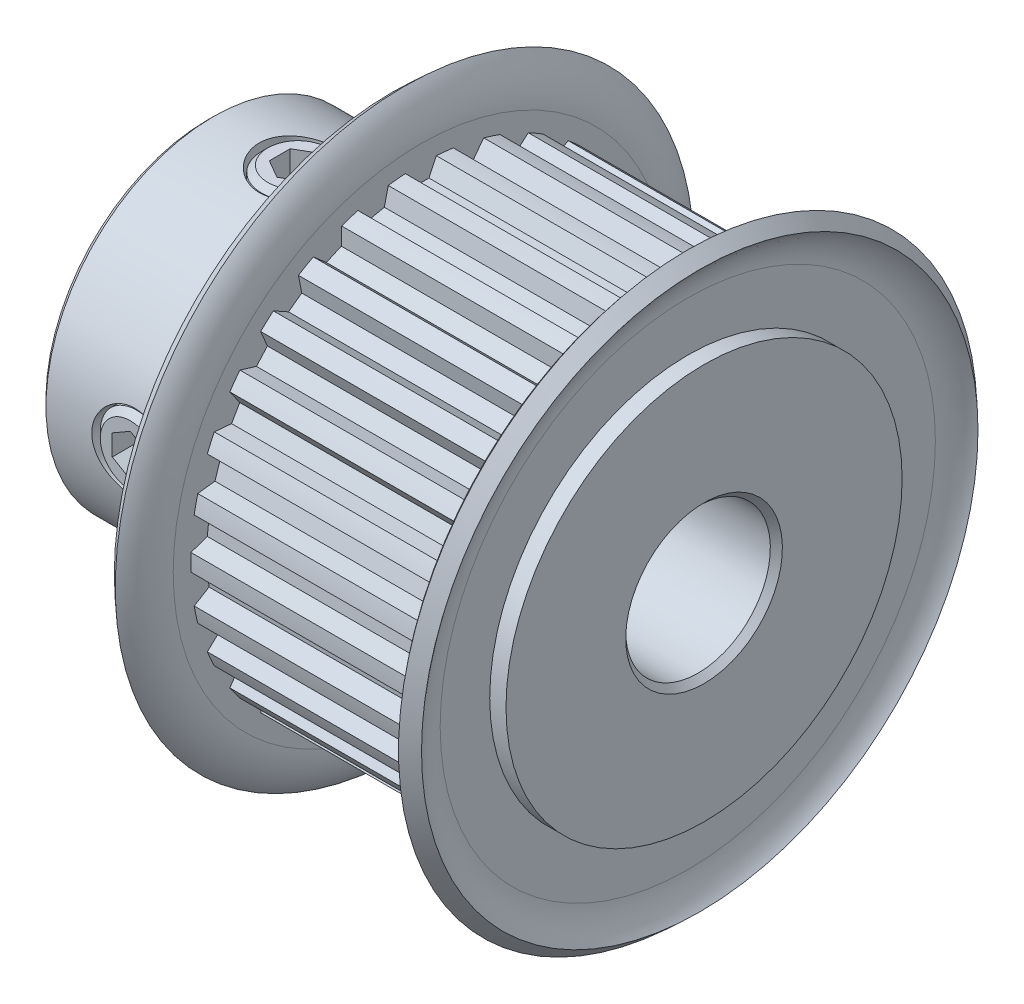
from build123d import *

# Parameters (mm, degrees)
SKETCH4_R          = 9.7
SKETCH4_R_2        = 9.54125
CUT_EXTRUDE2_DEPTH = 10.4
CUT_EXTRUDE1_DEPTH = 10.4
CIRPATTERN1_COUNT  = 30
SKETCH6_R          = 1.6
CUT_EXTRUDE3_DEPTH = 20.851700179
CUT_EXTRUDE4_DEPTH = 1.016
CIRPATTERN2_COUNT  = 2
CIRPATTERN2_ANGLE  = 90
CIRPATTERN3_COUNT  = 2
CIRPATTERN3_ANGLE  = 90
CHAMFER1_SIZE      = 0.25


with BuildPart() as part:
    # Sketch1 → Revolve1 (revolve)
    with BuildSketch(Plane.XY, mode=Mode.PRIVATE) as revolve1_sk:
        with BuildLine():
            Line((-10.3, 3), (10.3, 3))
            Line((10.3, 3), (10.3, 12))
            Line((10.3, 12), (9.625, 12))
            ThreePointArc((9.625, 12), (9.124735294, 11.199311572), (8.95, 10.2715))
            Line((8.95, 10.2715), (8.95, 9.7))
            Line((8.95, 9.7), (-1.45, 9.7))
            Line((-1.45, 9.7), (-1.45, 10.2715))
            ThreePointArc((-1.45, 10.2715), (-1.624735294, 11.199311572), (-2.125, 12))
            Line((-2.125, 12), (-2.8, 12))
            Line((-2.8, 12), (-2.8, 6.95))
            Line((-2.8, 6.95), (-10.3, 6.95))
            Line((-10.3, 6.95), (-10.3, 3))
        make_face()
    revolve(revolve1_sk.sketch.rotate(Axis((-10.3, 0, 0), (1, 0, 0)), 180), axis=Axis((-10.3, 0, 0), (1, 0, 0)))

    # Sketch4 → Cut-Extrude2 (cut)
    with BuildSketch(Plane(origin=(-1.45, 0, 0), x_dir=(0, 0, -1), z_dir=(1, 0, 0))):
        Circle(SKETCH4_R)
        with Locations(Location((0, 0, 0), (0, 0, 90))):
            Circle(SKETCH4_R_2, mode=Mode.SUBTRACT)
    extrude(amount=CUT_EXTRUDE2_DEPTH, mode=Mode.SUBTRACT)

    # Sketch3 → Cut-Extrude1 (cut)
    with BuildSketch(Plane(origin=(-1.45, 0, 0), x_dir=(0, 0, -1), z_dir=(1, 0, 0))):
        with BuildLine():
            Line((-0.643519092, 9.519523872), (-0.339706568, 8.867995811))
            Line((-0.339706568, 8.867995811), (0.339706568, 8.867995811))
            Line((0.339706568, 8.867995811), (0.643519092, 9.519523872))
            ThreePointArc((0.643519092, 9.519523872), (0, 9.54125), (-0.643519092, 9.519523872))
        make_face()
    cut_extrude1 = extrude(amount=CUT_EXTRUDE1_DEPTH, mode=Mode.SUBTRACT)

    # CirPattern1: Cut-Extrude1 ×30 about axis
    cirpattern1_axis = Axis((0, 0, 0), (1, 0, 0))
    for i in range(1, CIRPATTERN1_COUNT):
        add(cut_extrude1.rotate(cirpattern1_axis, i * 360 / CIRPATTERN1_COUNT), mode=Mode.SUBTRACT)

    # Sketch6 → Cut-Extrude3 (cut, through all)
    with BuildSketch(Plane(origin=(0, 0, 0), x_dir=(1, 0, 0), z_dir=(0, 1, 0))):
        with Locations(Location((-6.55, 0, 0), (0, 0, 90))):
            Circle(SKETCH6_R)
    cut_extrude3 = extrude(amount=CUT_EXTRUDE3_DEPTH, mode=Mode.SUBTRACT)

    # CirPattern2: Cut-Extrude3 ×2 about axis
    cirpattern2_axis = Axis((-10.3, 0, 0), (1, 0, 0))
    for i in range(1, CIRPATTERN2_COUNT):
        add(cut_extrude3.rotate(cirpattern2_axis, i * CIRPATTERN2_ANGLE / (CIRPATTERN2_COUNT - 1)), mode=Mode.SUBTRACT)

    # Chamfer1
    chamfer1_edges = [part.edges().sort_by_distance(p)[0] for p in [
        (-10.3, 6.95, 0),
        (-10.3, 3, 0),
        (10.3, 3, 0),
    ]]
    chamfer(chamfer1_edges, length=CHAMFER1_SIZE)

    # Sketch9 → Cut-Revolve1 (revolve, cut)
    with BuildSketch(Plane.XY, mode=Mode.PRIVATE) as cut_revolve1_sk:
        with BuildLine():
            Line((9.625, 12), (10.121366975, 11.542567135))
            ThreePointArc((10.121366975, 11.542567135), (9.75349308, 10.953774108), (9.625, 10.2715))
            Line((9.625, 10.2715), (9.625, 8.21646775))
            Line((9.625, 8.21646775), (10.3, 8.21646775))
            Line((10.3, 8.21646775), (10.3, 12))
            Line((10.3, 12), (9.934992335, 12.336377137))
            Line((9.934992335, 12.336377137), (9.625, 12))
        make_face()
    cut_revolve1 = revolve(cut_revolve1_sk.sketch.rotate(Axis((-10.3, 0, 0), (1, 0, 0)), 180), axis=Axis((-10.3, 0, 0), (1, 0, 0)), mode=Mode.SUBTRACT)

    # Mirror1: Cut-Revolve1 across plane
    add(cut_revolve1.mirror(Plane(origin=(3.75, 0, 0), x_dir=(0, 0, 1), z_dir=(1, 0, 0))), mode=Mode.SUBTRACT)


with BuildPart() as body_2:
    # Sketch7 → Revolve2 (revolve)
    with BuildSketch(Plane.XY, mode=Mode.PRIVATE) as revolve2_sk:
        Polygon((-7.796, 6.95), (-6.55, 6.95), (-6.55, 3.381), (-7.796, 3.381), (-8.05, 3.635), (-8.05, 6.696), align=None)
    revolve(revolve2_sk.sketch.rotate(Axis((-6.55, 3.381, 0), (0, 1, 0)), 270), axis=Axis((-6.55, 3.381, 0), (0, 1, 0)))

    # Sketch8 → Cut-Extrude4 (cut)
    with BuildSketch(Plane(origin=(0, 6.95, 0), x_dir=(1, 0, 0), z_dir=(0, 1, 0))):
        Polygon((-6.55, 0.866025404), (-7.3, 0.433012702), (-7.3, -0.433012702), (-6.55, -0.866025404), (-5.8, -0.433012702), (-5.8, 0.433012702), align=None)
    extrude(amount=-CUT_EXTRUDE4_DEPTH, mode=Mode.SUBTRACT)


with BuildPart() as cirpattern3_1:
    # CirPattern3: pattern copy
    add(body_2.part.rotate(Axis((0, 0, 0), (1, 0, 0)), 1 * CIRPATTERN3_ANGLE / (CIRPATTERN3_COUNT - 1)))


solid = Compound([part.part, body_2.part, cirpattern3_1.part])
